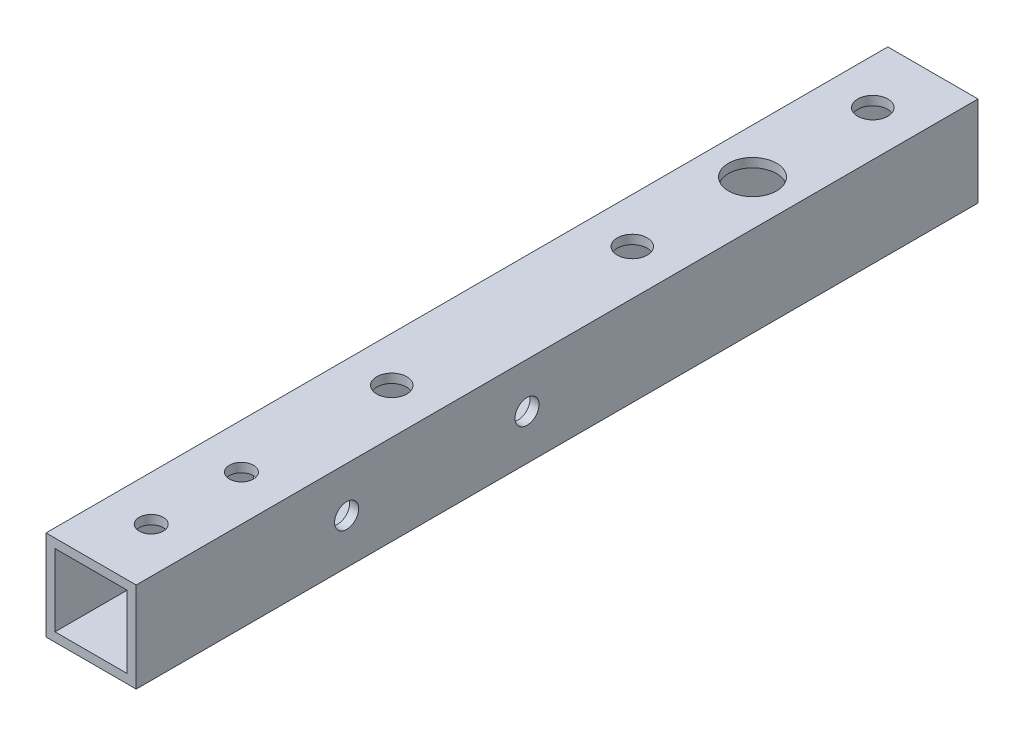
from build123d import *

# Parameters (mm, degrees)
SKETCH_1_W          = 15
SKETCH_1_H          = 15
SKETCH_1_W_2        = 12
SKETCH_1_H_2        = 12
EXTRUDE_1_DEPTH     = 140
SKETCH_3_R          = 4
CUT_EXTRUDE_1_DEPTH = 22
SKETCH_4_R          = 2
CUT_EXTRUDE_2_DEPTH = 75
SKETCH_5_R          = 2
CUT_EXTRUDE_3_DEPTH = 24
SKETCH_6_R          = 2.5
CUT_EXTRUDE_4_DEPTH = 142.000886522
SKETCH_7_R          = 2.5
CUT_EXTRUDE_5_DEPTH = 142.000886522


with BuildPart() as part:
    # 草图1 → 凸台-拉伸1 (new body)
    with BuildSketch(Plane.XY):
        Rectangle(SKETCH_1_W, SKETCH_1_H)
        Rectangle(SKETCH_1_W_2, SKETCH_1_H_2, mode=Mode.SUBTRACT)
    extrude(amount=EXTRUDE_1_DEPTH)

    # 草图3 → 切除-拉伸1 (cut)
    with BuildSketch(Plane(origin=(0, 7.5, 0), x_dir=(1, 0, 0), z_dir=(0, 1, 0))):
        with Locations(Location((0, -30, 0), (0, 0, 270))):
            Circle(SKETCH_3_R)
    extrude(amount=-CUT_EXTRUDE_1_DEPTH, mode=Mode.SUBTRACT)

    # 草图4 → 切除-拉伸2 (cut)
    with BuildSketch(Plane.XZ.offset(7.5)):
        with Locations(Location((0, 130, 0), (0, 0, 270))):
            Circle(SKETCH_4_R)
        with Locations(Location((0, 115, 0), (0, 0, 270))):
            Circle(SKETCH_4_R)
    extrude(amount=-CUT_EXTRUDE_2_DEPTH, mode=Mode.SUBTRACT)

    # 草图5 → 切除-拉伸3 (cut)
    with BuildSketch(Plane(origin=(7.5, 0, 0), x_dir=(0, 0, -1), z_dir=(1, 0, 0))):
        with Locations((-105, 0)):
            Circle(SKETCH_5_R)
        with Locations((-75, 0)):
            Circle(SKETCH_5_R)
    extrude(amount=-CUT_EXTRUDE_3_DEPTH, mode=Mode.SUBTRACT)

    # 草图6 → 切除-拉伸4 (cut, through all)
    with BuildSketch(Plane.XZ.offset(7.5)):
        with Locations(Location((0, 50, 0), (0, 0, 270))):
            Circle(SKETCH_6_R)
        with Locations(Location((0, 10, 0), (0, 0, 90))):
            Circle(SKETCH_6_R)
    extrude(amount=-CUT_EXTRUDE_4_DEPTH, mode=Mode.SUBTRACT)

    # 草图7 → 切除-拉伸5 (cut, through all)
    with BuildSketch(Plane(origin=(0, 7.5, 0), x_dir=(1, 0, 0), z_dir=(0, 1, 0))):
        with Locations(Location((0, -90, 0), (0, 0, 270))):
            Circle(SKETCH_7_R)
    extrude(amount=-CUT_EXTRUDE_5_DEPTH, mode=Mode.SUBTRACT)


solid = part.part
